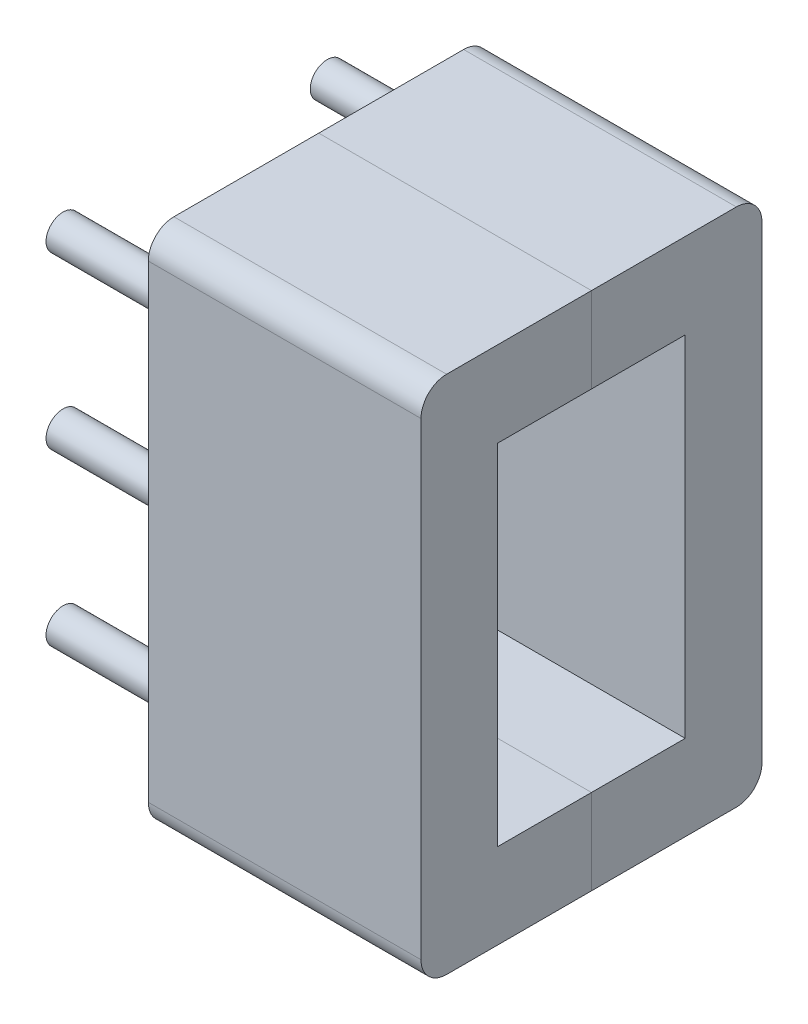
from build123d import *

# Parameters (mm, degrees)
CROQUIS2_W                 = 40
CROQUIS2_H                 = 61
SALIENTE_EXTRUIR1_DEPTH    = 32
CORTAR_EXTRUIR1_DEPTH      = 58.370121173
CORTAR_EXTRUIR1_DEPTH_BACK = 58.370121173
CROQUIS4_W                 = 22
CROQUIS4_H                 = 41
CORTAR_EXTRUIR2_DEPTH      = 58.370121173
CORTAR_EXTRUIR2_DEPTH_BACK = 8
CROQUIS5_W                 = 19
CROQUIS5_H                 = 53
SALIENTE_EXTRUIR2_START    = 2.5
CROQUIS7_W                 = 19
CROQUIS7_H                 = 6
SALIENTE_EXTRUIR2_DEPTH    = 5.5
CROQUIS9_R                 = 2
SALIENTE_EXTRUIR3_DEPTH    = 14.5
REDONDEO1_R                = 3


with BuildPart() as part:
    # Croquis2 → Saliente-Extruir1 (new body)
    with BuildSketch(Plane(origin=(0, 0, 0), x_dir=(0, 0, -1), z_dir=(1, 0, 0))):
        with Locations((0, -12.712623195)):
            Rectangle(CROQUIS2_W, CROQUIS2_H)
    extrude(amount=-SALIENTE_EXTRUIR1_DEPTH)

    # Croquis4 → Cortar-Extruir1 (cut, two sides: drawn at the far end of the back side and taken through both)
    with BuildSketch(Plane(origin=(0, 0, 0), x_dir=(0, 0, -1), z_dir=(1, 0, 0)).offset(-CORTAR_EXTRUIR1_DEPTH_BACK)):
        with Locations((0, -12.712623195)):
            Rectangle(CROQUIS4_W, CROQUIS4_H)
    extrude(amount=CORTAR_EXTRUIR1_DEPTH + CORTAR_EXTRUIR1_DEPTH_BACK, mode=Mode.SUBTRACT)

    # Croquis5 → Cortar-Extruir2 (cut, two sides: drawn at the far end of the back side and taken through both)
    with BuildSketch(Plane.ZY.offset(32).offset(-CORTAR_EXTRUIR2_DEPTH_BACK)):
        with Locations((0, -12.712623195)):
            Rectangle(CROQUIS5_W, CROQUIS5_H)
    extrude(amount=CORTAR_EXTRUIR2_DEPTH + CORTAR_EXTRUIR2_DEPTH_BACK, mode=Mode.SUBTRACT)

    # Croquis7 → Saliente-Extruir2 (add)
    with BuildSketch(Plane.ZY.offset(24).offset(SALIENTE_EXTRUIR2_START)):
        with Locations((0, 10.787376805)):
            Rectangle(CROQUIS7_W, CROQUIS7_H)
        with Locations((0, -36.212623195)):
            Rectangle(CROQUIS7_W, CROQUIS7_H)
    extrude(amount=SALIENTE_EXTRUIR2_DEPTH)

    # Croquis9 → Saliente-Extruir3 (add)
    with BuildSketch(Plane(origin=(-32, 0, 0), x_dir=(0, 0, -1), z_dir=(1, 0, 0))):
        with Locations((-15.5, 8.269876805)):
            Circle(CROQUIS9_R)
        with Locations((-15.5, -31.730123195)):
            Circle(CROQUIS9_R)
        with Locations((-15.5, -11.730123195)):
            Circle(CROQUIS9_R)
        with Locations((15.5, -31.730123195)):
            Circle(CROQUIS9_R)
        with Locations((15.5, -11.730123195)):
            Circle(CROQUIS9_R)
        with Locations((15.5, 8.269876805)):
            Circle(CROQUIS9_R)
    extrude(amount=-SALIENTE_EXTRUIR3_DEPTH)

    # Redondeo1
    redondeo1_edges = [part.edges().sort_by_distance(p)[0] for p in [
        (-16, -43.212623195, -20),
        (-16, -43.212623195, 20),
        (-16, 17.787376805, 20),
        (-16, 17.787376805, -20),
    ]]
    fillet(redondeo1_edges, radius=REDONDEO1_R)


with BuildPart() as body_2:
    # Partir1: the piece on the far side of the plane
    add(part.part)
    split(bisect_by=Plane.XY, keep=Keep.BOTTOM)


with BuildPart() as part_1:
    add(part.part)

    # Partir1
    split(bisect_by=Plane.XY, keep=Keep.TOP)


solid = Compound([body_2.part, part_1.part])
